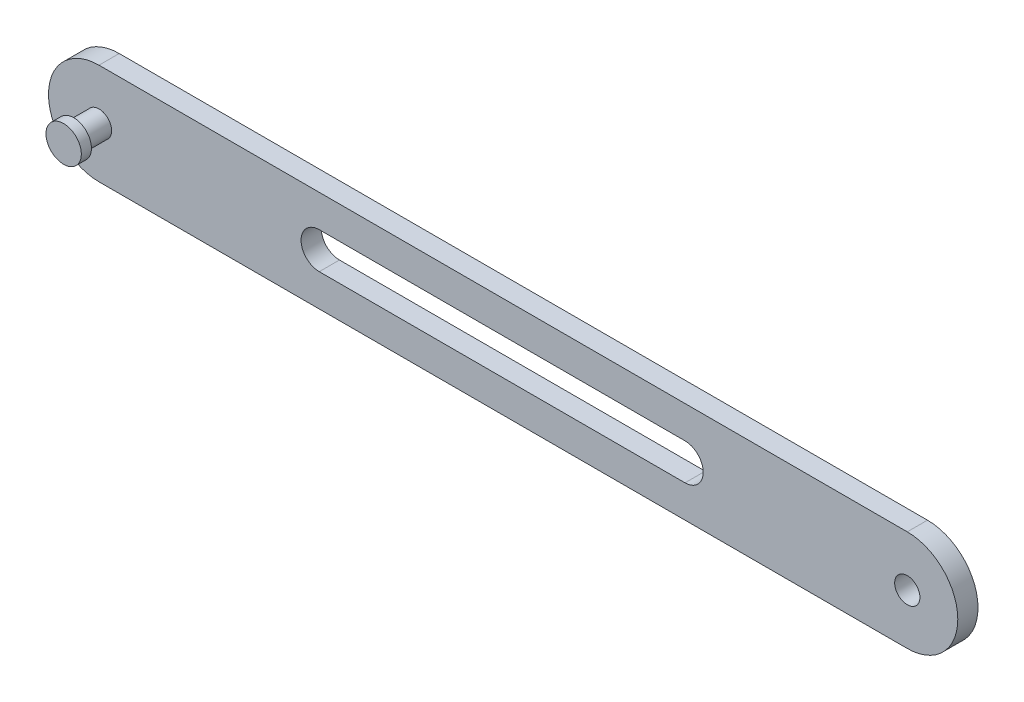
from build123d import *

# Parameters (mm, degrees)
BOSS_EXTRUDE1_DEPTH = 2.54
SKETCH2_R           = 3.175
CUT_EXTRUDE1_DEPTH  = 116.115535007
CUT_EXTRUDE2_DEPTH  = 116.115535007
SKETCH4_R           = 3.175
BOSS_EXTRUDE2_DEPTH = 8.89
SKETCH5_R           = 4.445
BOSS_EXTRUDE3_DEPTH = 2.54


with BuildPart() as part:
    # Sketch1 → Boss-Extrude1 (new, symmetric)
    with BuildSketch(Plane.XY):
        with BuildLine():
            Line((-101.6, 12.7), (101.6, 12.7))
            ThreePointArc((101.6, 12.7), (114.3, 0), (101.6, -12.7))
            Line((101.6, -12.7), (-101.6, -12.7))
            ThreePointArc((-101.6, -12.7), (-114.3, 0), (-101.6, 12.7))
        make_face()
    extrude(amount=BOSS_EXTRUDE1_DEPTH, both=True)

    # Sketch2 → Cut-Extrude1 (cut, through all)
    with BuildSketch(Plane.XY.offset(2.54)):
        with Locations((101.6, 0)):
            Circle(SKETCH2_R)
    extrude(amount=-CUT_EXTRUDE1_DEPTH, mode=Mode.SUBTRACT)

    # Sketch3 → Cut-Extrude2 (cut, through all)
    with BuildSketch(Plane.XY.offset(2.54)):
        with BuildLine():
            Line((-46.228, 4.572), (45.72, 4.572))
            ThreePointArc((45.72, 4.572), (50.292, 0), (45.72, -4.572))
            Line((45.72, -4.572), (-46.228, -4.572))
            ThreePointArc((-46.228, -4.572), (-50.8, 0), (-46.228, 4.572))
        make_face()
    extrude(amount=-CUT_EXTRUDE2_DEPTH, mode=Mode.SUBTRACT)

    # Sketch4 → Boss-Extrude2 (add)
    with BuildSketch(Plane.XY.offset(2.54)):
        with Locations((-101.6, 0)):
            Circle(SKETCH4_R)
    extrude(amount=BOSS_EXTRUDE2_DEPTH)

    # Sketch5 → Boss-Extrude3 (add)
    with BuildSketch(Plane.XY.offset(11.43)):
        with Locations((-101.6, 0)):
            Circle(SKETCH5_R)
    extrude(amount=-BOSS_EXTRUDE3_DEPTH)


solid = part.part
